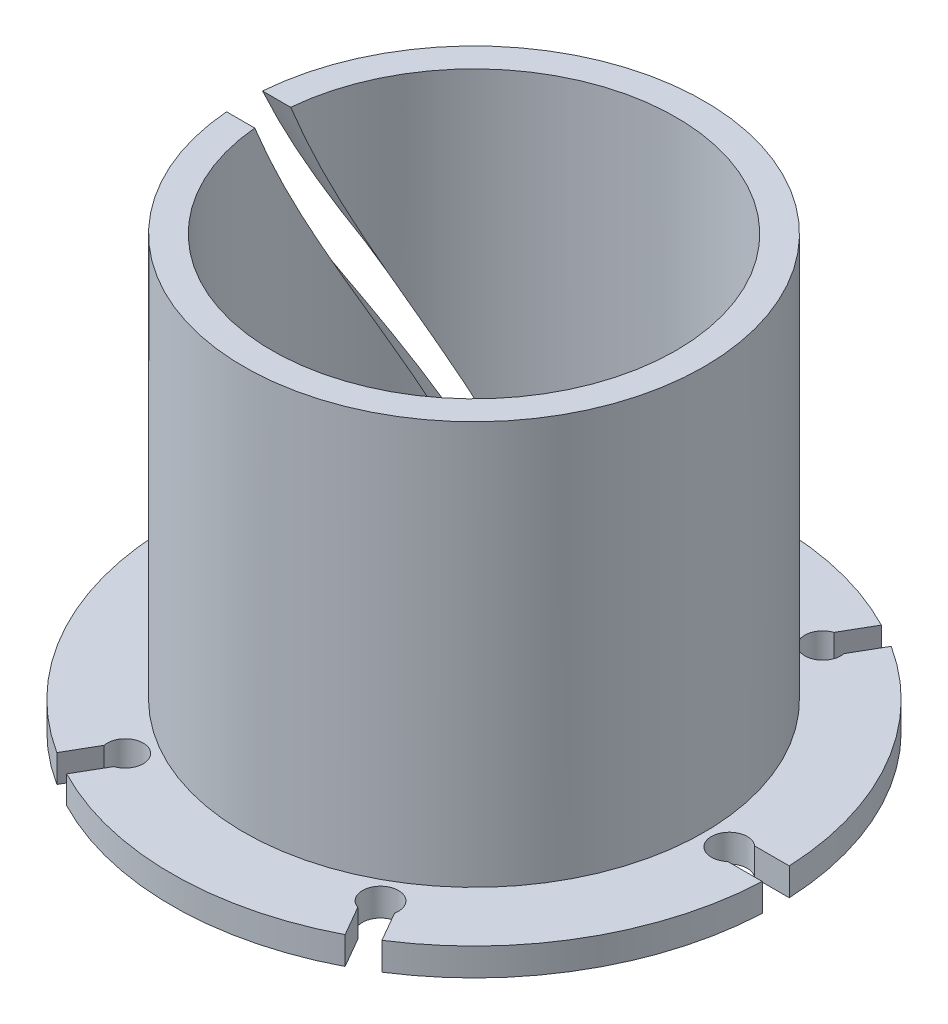
from build123d import *

# Parameters (mm, degrees)
SKETCH2_R           = 6.35
SKETCH2_R_2         = 5.5753
BOSS_EXTRUDE1_DEPTH = 11.8872
SKETCH3_R           = 8.334375
SKETCH3_R_2         = 6.35
BOSS_EXTRUDE2_DEPTH = 0.762
CUT_EXTRUDE1_DEPTH  = 17.207827995
CIRPATTERN1_COUNT   = 6


with BuildPart() as part:
    # Sketch2 → Boss-Extrude1 (new body)
    with BuildSketch(Plane(origin=(0, 0, 0), x_dir=(1, 0, 0), z_dir=(0, 1, 0))):
        with Locations(Location((0, 0, 0), (0, 0, 270))):
            Circle(SKETCH2_R)
        with Locations(Location((0, 0, 0), (0, 0, 270))):
            Circle(SKETCH2_R_2, mode=Mode.SUBTRACT)
    extrude(amount=BOSS_EXTRUDE1_DEPTH)

    # Sketch3 → Boss-Extrude2 (add)
    with BuildSketch(Plane(origin=(0, 0, 0), x_dir=(1, 0, 0), z_dir=(0, 1, 0))):
        with Locations(Location((0, 0, 0), (0, 0, 90))):
            Circle(SKETCH3_R)
        with Locations(Location((0, 0, 0), (0, 0, 270))):
            Circle(SKETCH3_R_2, mode=Mode.SUBTRACT)
    extrude(amount=BOSS_EXTRUDE2_DEPTH)

    # Sketch7 → Cut-Extrude1 (cut, through all)
    with BuildSketch(Plane(origin=(0, 0.762, 0), x_dir=(1, 0, 0), z_dir=(0, 1, 0))):
        with BuildLine():
            Line((-7.372666422, 0.372070313), (-8.334375, 0.372070312))
            Line((-8.334375, 0.372070312), (-8.334375, -0.372070312))
            Line((-8.334375, -0.372070312), (-7.372666422, -0.372070313))
            ThreePointArc((-7.372666422, -0.372070313), (-6.5484375, 0), (-7.372666422, 0.372070313))
        make_face()
    cut_extrude1 = extrude(amount=-CUT_EXTRUDE1_DEPTH, mode=Mode.SUBTRACT)

    # CirPattern1: Cut-Extrude1 ×6 about axis, 1 skipped
    cirpattern1_axis = Axis((0, 11.8872, 0), (0, -1, 0))
    add([cut_extrude1.rotate(cirpattern1_axis, i * 360 / CIRPATTERN1_COUNT) for i in range(1, CIRPATTERN1_COUNT) if i not in (1,)], mode=Mode.SUBTRACT)

    # Sketch13 → Cut-Loft1 section 0
    with BuildSketch(Plane.XZ):
        with BuildLine():
            Line((-3.206222175, -4.561152207), (-5.86681729, -9.169438125))
            Line((-5.86681729, -9.169438125), (-5.00755771, -9.665531875))
            Line((-5.00755771, -9.665531875), (-2.346962594, -5.057245957))
            Line((-2.346962594, -5.057245957), (-3.206222175, -4.561152207))
        make_face()
    # Sketch12 → Cut-Loft1 section 1
    with BuildSketch(Plane(origin=(0, 11.8872, 0), x_dir=(1, 0, 0), z_dir=(0, 1, 0))):
        with BuildLine():
            Line((-10.874375, 0.49609375), (-5.553184769, 0.49609375))
            Line((-5.553184769, 0.49609375), (-5.553184769, -0.49609375))
            Line((-5.553184769, -0.49609375), (-10.874375, -0.49609375))
            Line((-10.874375, -0.49609375), (-10.874375, 0.49609375))
        make_face()
    loft(mode=Mode.SUBTRACT)


solid = part.part
